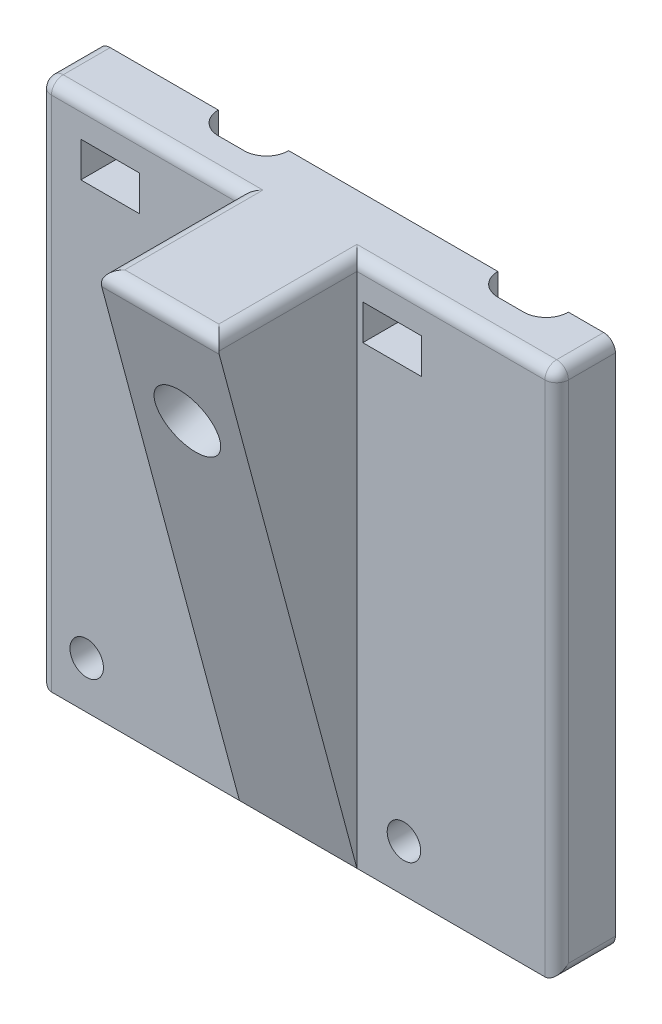
from build123d import *

# Parameters (mm, degrees)
SKETCH1_W                           = 44
SKETCH1_H                           = 45
BASE_DEPTH                          = 5
WIRE_GROOVES_DEPTH                  = 51.338851795
SLANTED_START                       = -22
SLANTED_SCREW_PLATFORM_DEPTH        = 5
SKETCH5_R                           = 2.75
MOUNTING_HOLE_SCREW_INSERTION_DEPTH = 36.040152348
SKETCH6_W                           = 5
SKETCH6_H                           = 3
ZIP_TIE_SLOTS_DEPTH                 = 34.699235283
SKETCH7_R                           = 1.425
MOUNT_CLAMPING_HOLES_DEPTH          = 34.699235283
EDGE_FILLETS_R                      = 1


with BuildPart() as part:
    # Sketch1 → Base (new body)
    with BuildSketch(Plane.XY):
        Rectangle(SKETCH1_W, SKETCH1_H)
    extrude(amount=BASE_DEPTH)

    # Sketch2 → Wire Grooves (cut, through all)
    with BuildSketch(Plane(origin=(0, 22.5, 0), x_dir=(1, 0, 0), z_dir=(0, 1, 0))):
        with BuildLine():
            Line((12, 0), (18, 0))
            ThreePointArc((18, 0), (17.443502884, -1.343502884), (16.1, -1.9))
            Line((16.1, -1.9), (13.9, -1.9))
            ThreePointArc((13.9, -1.9), (12.556497116, -1.343502884), (12, 0))
        make_face()
        with BuildLine():
            Line((-7.7, -1.9), (-9.9, -1.9))
            ThreePointArc((-9.9, -1.9), (-11.243502884, -1.343502884), (-11.8, 0))
            Line((-11.8, 0), (-5.8, 0))
            ThreePointArc((-5.8, 0), (-6.356497116, -1.343502884), (-7.7, -1.9))
        make_face()
    extrude(amount=-WIRE_GROOVES_DEPTH, mode=Mode.SUBTRACT)

    # Sketch4 → Slanted Screw Platform (add, symmetric)
    with BuildSketch(Plane(origin=(22, 0, 0), x_dir=(0, 0, -1), z_dir=(1, 0, 0)).offset(SLANTED_START)):
        Polygon((-5, -22.5), (-5, 22.5), (-17.057713659, 22.5), align=None)
    extrude(amount=SLANTED_SCREW_PLATFORM_DEPTH, both=True)

    # Sketch5 → Mounting Hole Screw Insertion (cut, through all)
    with BuildSketch(Plane(origin=(0, -2.757214207, 10.290063509), x_dir=(1, 0, 0), z_dir=(0, -0.2588190451025216, 0.9659258262890681))):
        with Locations(Location((0, 16, 0), (0, 0, 270))):
            Circle(SKETCH5_R)
    extrude(amount=-MOUNTING_HOLE_SCREW_INSERTION_DEPTH, mode=Mode.SUBTRACT)

    # Sketch6 → Zip Tie Slots (cut, through all)
    with BuildSketch(Plane.XY.offset(5)):
        with Locations((-16, 18)):
            Rectangle(SKETCH6_W, SKETCH6_H)
        with Locations((8, 18)):
            Rectangle(SKETCH6_W, SKETCH6_H)
    extrude(amount=-ZIP_TIE_SLOTS_DEPTH, mode=Mode.SUBTRACT)

    # Sketch7 → Mount Clamping Holes (cut, through all)
    with BuildSketch(Plane.XY.offset(5)):
        with Locations((-18, -18.5)):
            Circle(SKETCH7_R)
        with Locations(Location((9, -18.5, 0), (0, 0, 180))):
            Circle(SKETCH7_R)
    extrude(amount=-MOUNT_CLAMPING_HOLES_DEPTH, mode=Mode.SUBTRACT)

    # Edge Fillets
    edge_fillets_edges = [part.edges().sort_by_distance(p)[0] for p in [
        (-22, 0, 5),
        (-13.5, 22.5, 5),
        (-5, 22.5, 11.02885683),
        (0, 22.5, 17.057713659),
        (22, 0, 5),
        (5, 22.5, 11.02885683),
        (22, -22.5, 2.5),
        (-22, -22.5, 2.5),
        (-22, 22.5, 2.5),
        (22, 22.5, 2.5),
        (13.5, 22.5, 5),
    ]]
    fillet(edge_fillets_edges, radius=EDGE_FILLETS_R)


solid = part.part
